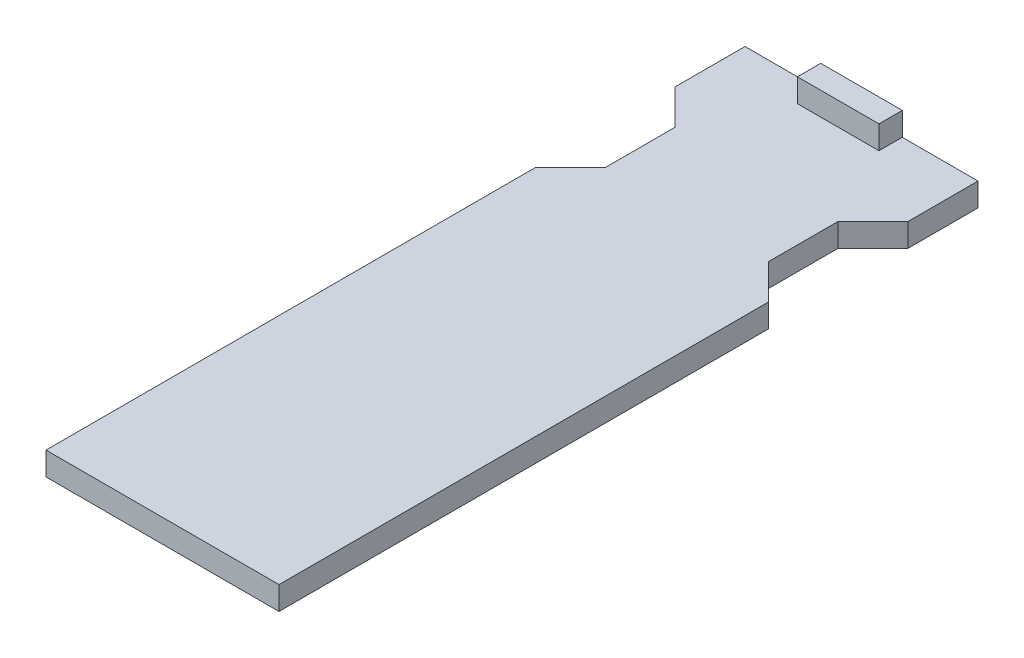
from build123d import *

# Parameters (mm, degrees)
BOSS_EXTRUDE1_DEPTH = 2
SKETCH2_W           = 7
SKETCH2_H           = 2
BOSS_EXTRUDE2_DEPTH = 2


with BuildPart() as part:
    # Sketch1 → Boss-Extrude1 (new body)
    with BuildSketch(Plane(origin=(0, 0, 0), x_dir=(1, 0, 0), z_dir=(0, 1, 0))):
        Polygon((0, 60), (0, 54), (3, 51), (3, 45), (0, 42), (0, 0), (20, 0), (20, 42), (17, 45), (17, 51), (20, 54), (20, 60), align=None)
    extrude(amount=BOSS_EXTRUDE1_DEPTH)


with BuildPart() as body_2:
    # Sketch2 → Boss-Extrude2 (new body)
    with BuildSketch(Plane(origin=(0, 2, 0), x_dir=(1, 0, 0), z_dir=(0, 1, 0))):
        with Locations((10, 59)):
            Rectangle(SKETCH2_W, SKETCH2_H)
    extrude(amount=BOSS_EXTRUDE2_DEPTH)


solid = Compound([part.part, body_2.part])
